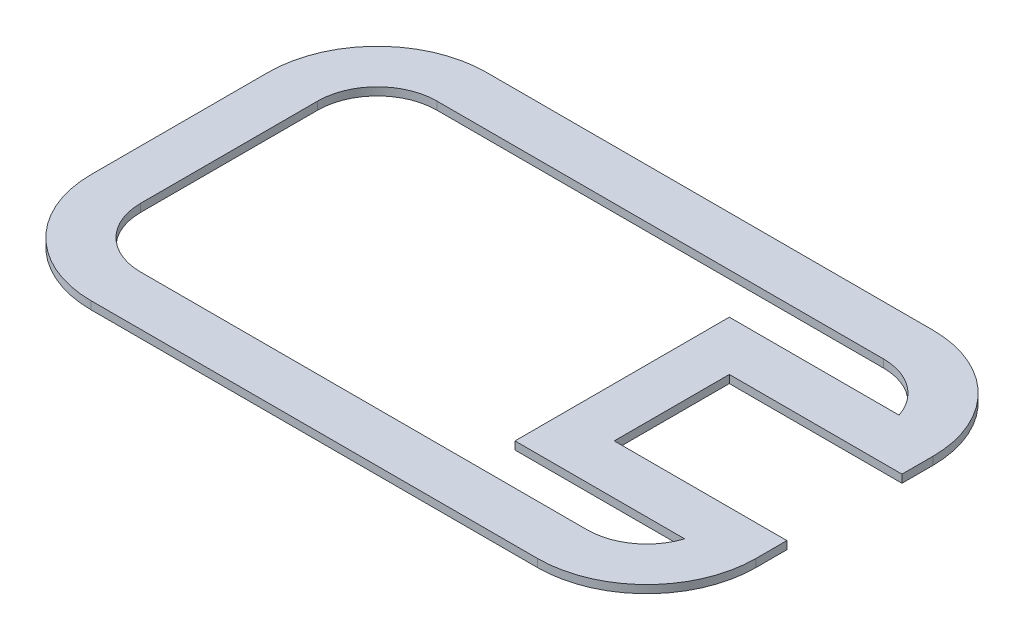
from build123d import *

# Parameters (mm, degrees)
BOSS_EXTRUDE1_DEPTH = 4


with BuildPart() as part:
    # Sketch1 → Boss-Extrude1 (new body)
    with BuildSketch(Plane(origin=(0, 0, 0), x_dir=(1, 0, 0), z_dir=(0, 1, 0))):
        with BuildLine():
            Line((278.528525026, -100.279082593), (278.528525026, -115.909082593))
            ThreePointArc((278.528525026, -115.909082593), (262.419397991, -154.799955558), (223.528525026, -170.909082593))
            Line((223.528525026, -170.909082593), (-1.501474974, -170.909082593))
            ThreePointArc((-1.501474974, -170.909082593), (-40.392347939, -154.799955558), (-56.501474974, -115.909082593))
            Line((-56.501474974, -115.909082593), (-56.501474974, -26.649082593))
            ThreePointArc((-56.501474974, -26.649082593), (-40.392347939, 12.241790373), (-1.501474974, 28.350917407))
            Line((-1.501474974, 28.350917407), (223.528525026, 28.350917407))
            ThreePointArc((223.528525026, 28.350917407), (262.419397991, 12.241790373), (278.528525026, -26.649082593))
            Line((278.528525026, -26.649082593), (278.528525026, -42.279082593))
            Line((278.528525026, -42.279082593), (191.528525026, -42.279082593))
            Line((191.528525026, -42.279082593), (191.528525026, -100.279082593))
            Line((191.528525026, -100.279082593), (278.528525026, -100.279082593))
        make_face()
        with BuildLine():
            Line((-1.501474974, -145.909082593), (223.528525026, -145.909082593))
            ThreePointArc((223.528525026, -145.909082593), (241.119716003, -140.210317129), (252.027702207, -125.279082593))
            Line((252.027702207, -125.279082593), (166.528525026, -125.279082593))
            Line((166.528525026, -125.279082593), (166.528525026, -17.279082593))
            Line((166.528525026, -17.279082593), (252.027702207, -17.279082593))
            ThreePointArc((252.027702207, -17.279082593), (241.119716003, -2.347848056), (223.528525026, 3.350917407))
            Line((223.528525026, 3.350917407), (-1.501474974, 3.350917407))
            ThreePointArc((-1.501474974, 3.350917407), (-22.71467841, -5.435879157), (-31.501474974, -26.649082593))
            Line((-31.501474974, -26.649082593), (-31.501474974, -115.909082593))
            ThreePointArc((-31.501474974, -115.909082593), (-22.71467841, -137.122286028), (-1.501474974, -145.909082593))
        make_face(mode=Mode.SUBTRACT)
    extrude(amount=BOSS_EXTRUDE1_DEPTH)


solid = part.part
